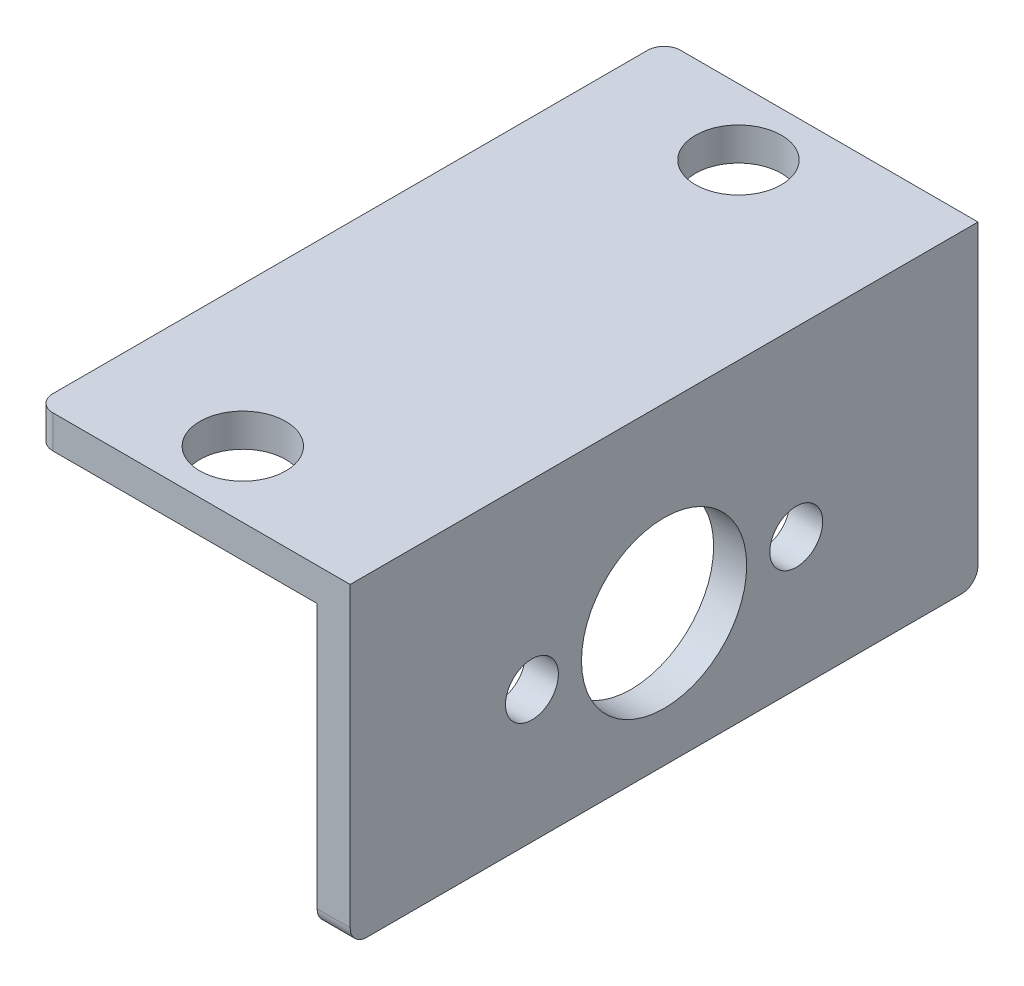
from build123d import *

# Parameters (mm, degrees)
BOSS_EXTRUDE1_DEPTH = 38
SKETCH2_R           = 5
SKETCH2_R_2         = 1.6
CUT_EXTRUDE1_DEPTH  = 47.540305113
SKETCH3_R           = 2.6
CUT_EXTRUDE2_DEPTH  = 46.760244755
FILLET1_R           = 1


with BuildPart() as part:
    # Sketch1 → Boss-Extrude1 (new body)
    with BuildSketch(Plane.XY):
        Polygon((0, 0), (0, -19), (-2, -19), (-2, -2), (-19, -2), (-19, 0), align=None)
    extrude(amount=BOSS_EXTRUDE1_DEPTH)

    # Sketch2 → Cut-Extrude1 (cut, through all)
    with BuildSketch(Plane(origin=(0, 0, 0), x_dir=(0, 0, -1), z_dir=(1, 0, 0))):
        with Locations(Location((-19, -11, 0), (0, 0, 90))):
            Circle(SKETCH2_R)
        with Locations(Location((-27, -11, 0), (0, 0, 90))):
            Circle(SKETCH2_R_2)
        with Locations((-11, -11)):
            Circle(SKETCH2_R_2)
    extrude(amount=-CUT_EXTRUDE1_DEPTH, mode=Mode.SUBTRACT)

    # Sketch3 → Cut-Extrude2 (cut, through all)
    with BuildSketch(Plane.XZ.offset(2)):
        with Locations((-10.5, 34)):
            Circle(SKETCH3_R)
        with Locations(Location((-10.5, 4, 0), (0, 0, 180))):
            Circle(SKETCH3_R)
    extrude(amount=-CUT_EXTRUDE2_DEPTH, mode=Mode.SUBTRACT)

    # Fillet1
    fillet1_edges = [part.edges().sort_by_distance(p)[0] for p in [
        (-1, -19, 38),
        (-1, -19, 0),
        (-19, -1, 38),
        (-19, -1, 0),
    ]]
    fillet(fillet1_edges, radius=FILLET1_R)


solid = part.part
